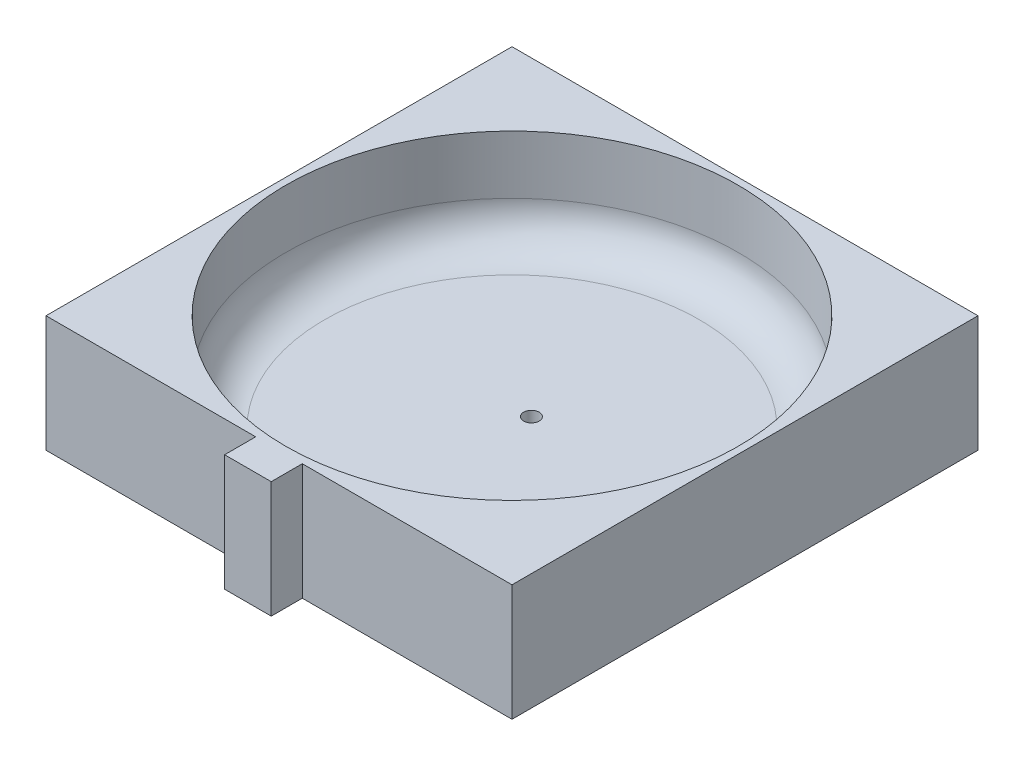
from build123d import *

# Parameters (mm, degrees)
SKETCH_1_W          = 120
SKETCH_1_H          = 120
EXTRUDE_1_DEPTH     = 30
SKETCH_2_R          = 58.25197646
CUT_EXTRUDE_1_DEPTH = 25
FILLET_1_R          = 10
SKETCH_3_R          = 2
CUT_EXTRUDE_2_DEPTH = 25
SKETCH_4_W          = 12
SKETCH_4_H          = 8
EXTRUDE_2_DEPTH     = 30


with BuildPart() as part:
    # 草图1 → 凸台-拉伸1 (new body)
    with BuildSketch(Plane(origin=(0, 0, 0), x_dir=(1, 0, 0), z_dir=(0, 1, 0))):
        Rectangle(SKETCH_1_W, SKETCH_1_H)
    extrude(amount=EXTRUDE_1_DEPTH)

    # 草图2 → 切除-拉伸1 (cut)
    with BuildSketch(Plane(origin=(0, 30, 0), x_dir=(1, 0, 0), z_dir=(0, 1, 0))):
        with Locations(Location((0, 0, 0), (0, 0, 270))):
            Circle(SKETCH_2_R)
    extrude(amount=-CUT_EXTRUDE_1_DEPTH, mode=Mode.SUBTRACT)

    # 圆角1
    fillet_1_edges = [part.edges().sort_by_distance(p)[0] for p in [
        (0, 5, -58.25197646),
    ]]
    fillet(fillet_1_edges, radius=FILLET_1_R)

    # 草图3 → 切除-拉伸2 (cut)
    with BuildSketch(Plane.XZ):
        with Locations(Location((0, -5, 0), (0, 0, 270))):
            Circle(SKETCH_3_R)
    extrude(amount=-CUT_EXTRUDE_2_DEPTH, mode=Mode.SUBTRACT)

    # 草图4 → 凸台-拉伸2 (add)
    with BuildSketch(Plane.XZ):
        with Locations((0, 64)):
            Rectangle(SKETCH_4_W, SKETCH_4_H)
    extrude(amount=-EXTRUDE_2_DEPTH)


solid = part.part
